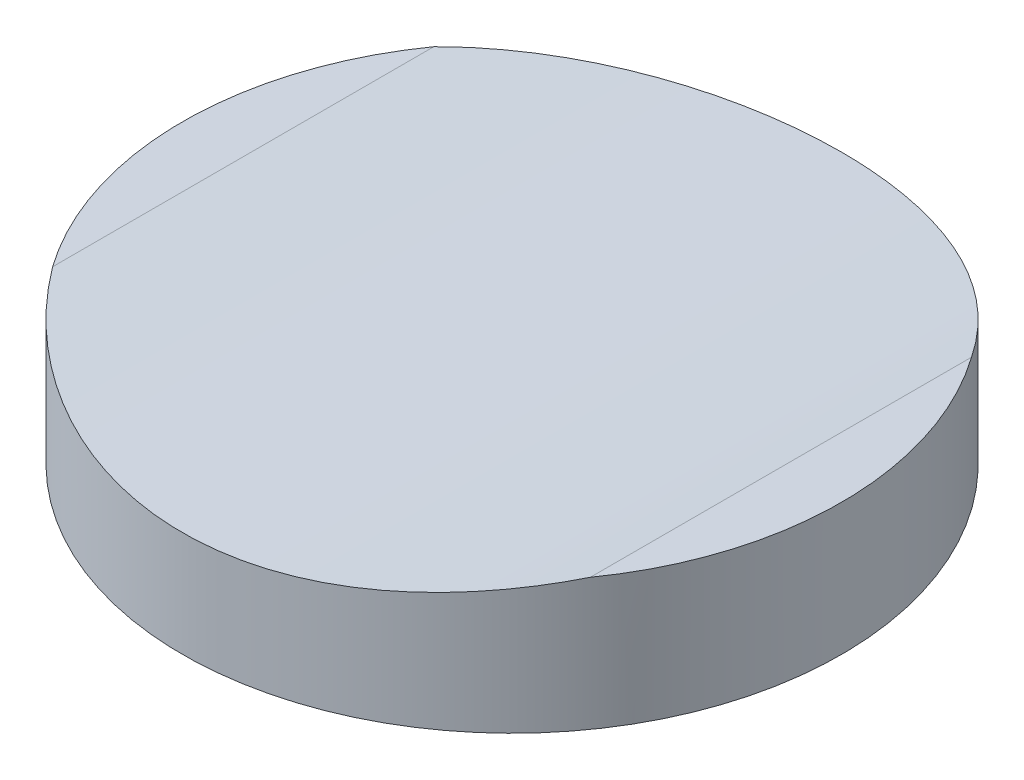
from build123d import *

# Parameters (mm, degrees)
SKETCH1_W                 = 25
SKETCH1_H                 = 10
CUT_EXTRUDE1_DEPTH        = 37.742346142
CUT_EXTRUDE1_DEPTH_BACK   = 37.742346142
SKETCH2_R                 = 105
F_3_0MM_DOWEL_HOLE1_D     = 3
F_3_0MM_DOWEL_HOLE1_DEPTH = 6


with BuildPart() as part:
    # Sketch1 → Revolve1 (revolve)
    with BuildSketch(Plane.XY, mode=Mode.PRIVATE) as revolve1_sk:
        with Locations((12.5, 5)):
            Rectangle(SKETCH1_W, SKETCH1_H)
    revolve(revolve1_sk.sketch.rotate(Axis((0, 0, 0), (0, 1, 0)), 90), axis=Axis((0, 0, 0), (0, 1, 0)))

    # Sketch2 → Cut-Extrude1 (cut, two sides: drawn at the far end of the back side and taken through both)
    with BuildSketch(Plane.XY.offset(-CUT_EXTRUDE1_DEPTH_BACK)):
        with Locations((0, 113)):
            Circle(SKETCH2_R)
    extrude(amount=CUT_EXTRUDE1_DEPTH + CUT_EXTRUDE1_DEPTH_BACK, mode=Mode.SUBTRACT)

    # Ø3.0mm Dowel Hole1
    with Locations(Plane(origin=(0, 0, 0), x_dir=(-1, 0, 0), z_dir=(0, -1, 0))):
        with Locations((17, 0)):
            Hole(F_3_0MM_DOWEL_HOLE1_D / 2, depth=F_3_0MM_DOWEL_HOLE1_DEPTH)


solid = part.part
